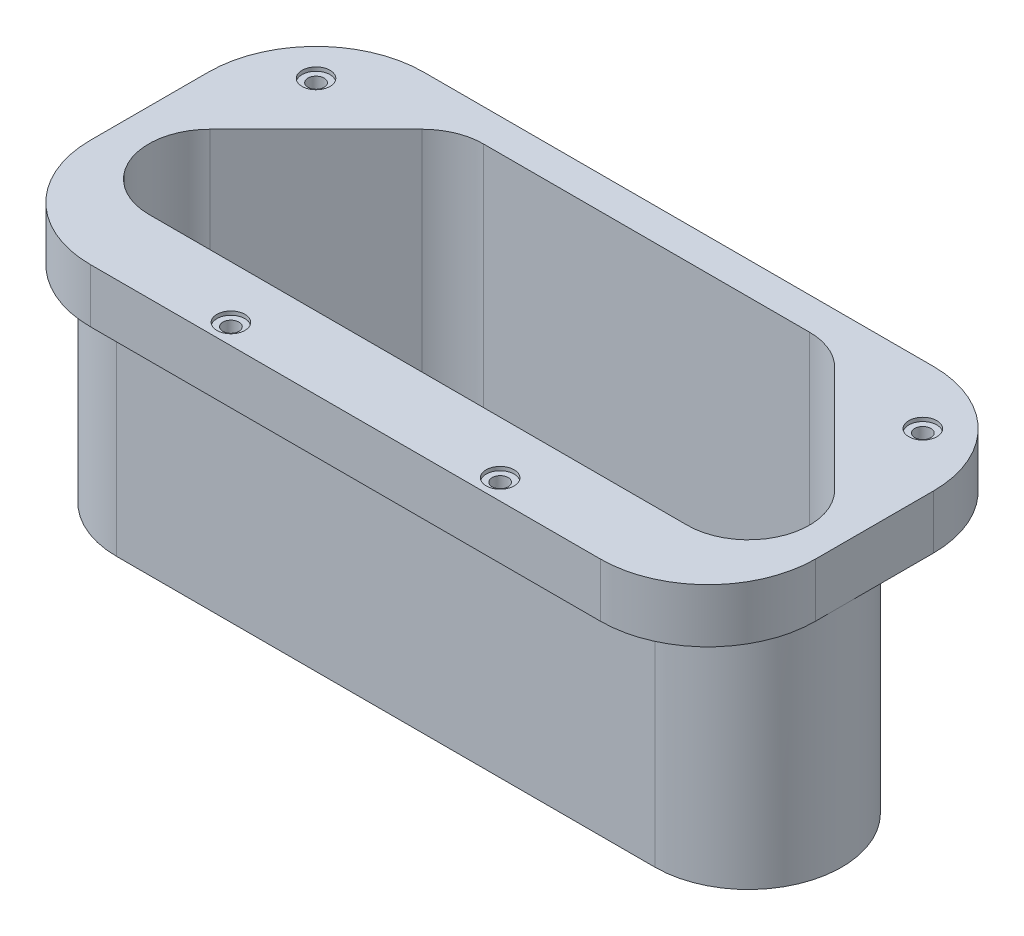
from build123d import *

# Parameters (mm, degrees)
SKETCH1_W             = 171.0436
SKETCH1_H             = 78.613
BOSS_EXTRUDE1_DEPTH   = 58.42
CUT_EXTRUDE1_DEPTH    = 45.72
BOSS_EXTRUDE2_START   = 7.62
BOSS_EXTRUDE2_DEPTH   = 7.62
FILLET1_R             = 25.4
F_6_CLEARANCE_HOLE2_D = 3.7973
SKETCH12_R            = 3.302
CUT_EXTRUDE2_DEPTH    = 0.889


with BuildPart() as part:
    # Sketch1 → Boss-Extrude1 (new body)
    with BuildSketch(Plane.XZ):
        with Locations((0, 0.485871825)):
            Rectangle(SKETCH1_W, SKETCH1_H)
        with BuildLine():
            Line((-73.683610441, -1.938038616), (-48.639210441, -26.982438616))
            ThreePointArc((-48.639210441, -26.982438616), (-43.966930256, -30.104356426), (-38.4556, -31.200628175))
            Line((-38.4556, -31.200628175), (38.4556, -31.200628175))
            ThreePointArc((38.4556, -31.200628175), (43.966930256, -30.104356426), (48.639210441, -26.982438616))
            Line((48.639210441, -26.982438616), (73.683610441, -1.938038616))
            ThreePointArc((73.683610441, -1.938038616), (76.805528251, 13.756902081), (63.5, 22.647371825))
            Line((63.5, 22.647371825), (-63.5, 22.647371825))
            ThreePointArc((-63.5, 22.647371825), (-76.805528251, 13.756902081), (-73.683610441, -1.938038616))
        make_face(mode=Mode.SUBTRACT)
    extrude(amount=BOSS_EXTRUDE1_DEPTH)

    # Sketch2 → Cut-Extrude1 (cut)
    with BuildSketch(Plane.XZ.offset(58.42)):
        with BuildLine():
            ThreePointArc((54.027364114, -32.370592289), (46.882978011, -37.144318464), (38.4556, -38.820628175))
            Line((38.4556, -38.820628175), (85.5218, -38.820628175))
            Line((85.5218, -38.820628175), (85.5218, 8.245571825))
            ThreePointArc((85.5218, 8.245571825), (83.845490289, -0.181806186), (79.071764114, -7.326192289))
            Line((79.071764114, -7.326192289), (54.027364114, -32.370592289))
        make_face()
        with BuildLine():
            Line((-85.5218, 8.245571825), (-85.5218, -38.820628175))
            Line((-85.5218, -38.820628175), (-38.4556, -38.820628175))
            ThreePointArc((-38.4556, -38.820628175), (-46.882978011, -37.144318464), (-54.027364114, -32.370592289))
            Line((-54.027364114, -32.370592289), (-79.071764114, -7.326192289))
            ThreePointArc((-79.071764114, -7.326192289), (-83.845490289, -0.181806186), (-85.5218, 8.245571825))
        make_face()
        with BuildLine():
            Line((-85.5218, 39.792371825), (-85.5218, 8.245571825))
            ThreePointArc((-85.5218, 8.245571825), (-79.071764114, 23.817335939), (-63.5, 30.267371825))
            Line((-63.5, 30.267371825), (63.5, 30.267371825))
            ThreePointArc((63.5, 30.267371825), (79.071764114, 23.817335939), (85.5218, 8.245571825))
            Line((85.5218, 8.245571825), (85.5218, 39.792371825))
            Line((85.5218, 39.792371825), (-85.5218, 39.792371825))
        make_face()
    extrude(amount=-CUT_EXTRUDE1_DEPTH, mode=Mode.SUBTRACT)

    # Sketch3 → Boss-Extrude2 (add)
    with BuildSketch(Plane.XZ.offset(58.42).offset(BOSS_EXTRUDE2_START)):
        with BuildLine():
            Line((-79.071764114, -7.326192289), (-54.027364114, -32.370592289))
            ThreePointArc((-54.027364114, -32.370592289), (-46.882978011, -37.144318464), (-38.4556, -38.820628175))
            Line((-38.4556, -38.820628175), (38.4556, -38.820628175))
            ThreePointArc((38.4556, -38.820628175), (46.882978011, -37.144318464), (54.027364114, -32.370592289))
            Line((54.027364114, -32.370592289), (79.071764114, -7.326192289))
            ThreePointArc((79.071764114, -7.326192289), (83.845490289, 16.672949836), (63.5, 30.267371825))
            Line((63.5, 30.267371825), (-63.5, 30.267371825))
            ThreePointArc((-63.5, 30.267371825), (-83.845490289, 16.672949836), (-79.071764114, -7.326192289))
        make_face()
    extrude(amount=-BOSS_EXTRUDE2_DEPTH)

    # Fillet1
    fillet1_edges = [part.edges().sort_by_distance(p)[0] for p in [
        (85.5218, -6.35, -38.820628175),
        (-85.5218, -6.35, -38.820628175),
        (-85.5218, -6.35, 39.792371825),
        (85.5218, -6.35, 39.792371825),
    ]]
    fillet(fillet1_edges, radius=FILLET1_R)

    # #6 Clearance Hole2 (through all)
    with Locations(Plane(origin=(0, -12.7, 0), x_dir=(-1, 0, 0), z_dir=(0, -1, 0))):
        with Locations((-31.75, -35.029871825), (-71.5518, 24.850628175)):
            f_6_clearance_hole2 = Hole(F_6_CLEARANCE_HOLE2_D / 2)

    # Mirror1: #6 Clearance Hole2 across plane
    add(f_6_clearance_hole2.mirror(Plane(origin=(0, 0, 0), x_dir=(0, 0, 1), z_dir=(1, 0, 0))), mode=Mode.SUBTRACT)

    # Sketch12 → Cut-Extrude2 (cut)
    with BuildSketch(Plane(origin=(0, 0, 0), x_dir=(1, 0, 0), z_dir=(0, 1, 0))):
        with Locations(Location((-71.5518, 24.850628175, 0), (0, 0, 270))):
            Circle(SKETCH12_R)
        with Locations(Location((-31.75, -35.029871825, 0), (0, 0, 270))):
            Circle(SKETCH12_R)
        with Locations(Location((31.75, -35.029871825, 0), (0, 0, 270))):
            Circle(SKETCH12_R)
        with Locations(Location((71.5518, 24.850628175, 0), (0, 0, 270))):
            Circle(SKETCH12_R)
    extrude(amount=-CUT_EXTRUDE2_DEPTH, mode=Mode.SUBTRACT)


solid = part.part
